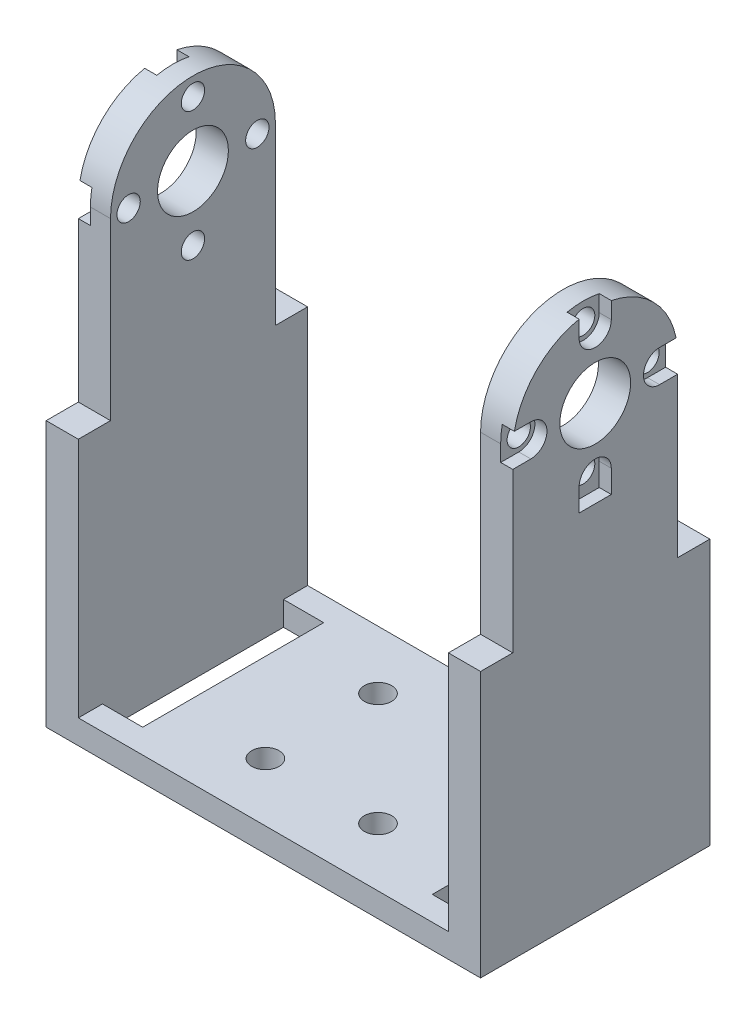
from build123d import *
from build123d.topology import SkipClean

# Parameters (mm, degrees)
SKETCH1_W           = 54
SKETCH1_H           = 28.5
SKETCH1_W_2         = 5
SKETCH1_H_2         = 22.5
SKETCH1_R           = 1.7
SKETCH1_R_2         = 7.5
BOSS_EXTRUDE2_DEPTH = 3
SKETCH2_W           = 4
SKETCH2_H           = 20.5
BOSS_EXTRUDE3_DEPTH = 21.75
SKETCH4_R           = 10.25
BOSS_EXTRUDE4_DEPTH = 4
SKETCH6_R           = 4.4
SKETCH6_R_2         = 1.45
CUT_EXTRUDE3_DEPTH  = 4
SKETCH7_R           = 1.45
CUT_EXTRUDE4_DEPTH  = 1.5
SKETCH8_W           = 28.781481152
SKETCH8_H           = 28.5
BOSS_EXTRUDE5_DEPTH = 3
SKETCH9_R           = 1.7
CUT_EXTRUDE5_DEPTH  = 3
SKETCH10_W          = 54
SKETCH10_H          = 28.5
SKETCH10_R          = 1.7
SKETCH10_W_2        = 5
SKETCH10_H_2        = 22.5
BOSS_EXTRUDE7_DEPTH = 30
SKETCH11_W          = 46
SKETCH11_H          = 30
CUT_EXTRUDE6_DEPTH  = 30


with BuildPart() as part:
    # Sketch1 → Boss-Extrude2 (new body)
    with BuildSketch(Plane(origin=(0, 0, 0), x_dir=(1, 0, 0), z_dir=(0, 1, 0))):
        Rectangle(SKETCH1_W, SKETCH1_H)
        with Locations((20.5, 0)):
            Rectangle(SKETCH1_W_2, SKETCH1_H_2, mode=Mode.SUBTRACT)
        with Locations((-20.5, 0)):
            Rectangle(SKETCH1_W_2, SKETCH1_H_2, mode=Mode.SUBTRACT)
        with Locations(Location((-9, -8.25, 0), (0, 0, 270))):
            Circle(SKETCH1_R, mode=Mode.SUBTRACT)
        with Locations(Location((9, -8.25, 0), (0, 0, 270))):
            Circle(SKETCH1_R, mode=Mode.SUBTRACT)
        with Locations(Location((-9, 8.25, 0), (0, 0, 270))):
            Circle(SKETCH1_R, mode=Mode.SUBTRACT)
        with Locations(Location((0, 0, 0), (0, 0, 270))):
            Circle(SKETCH1_R_2, mode=Mode.SUBTRACT)
        with Locations(Location((9, 8.25, 0), (0, 0, 270))):
            Circle(SKETCH1_R, mode=Mode.SUBTRACT)
    extrude(amount=BOSS_EXTRUDE2_DEPTH)

    # Sketch2 → Boss-Extrude3 (add)
    with BuildSketch(Plane(origin=(0, 3, 0), x_dir=(1, 0, 0), z_dir=(0, 1, 0))):
        with Locations((25, 0)):
            Rectangle(SKETCH2_W, SKETCH2_H)
    boss_extrude3 = extrude(amount=BOSS_EXTRUDE3_DEPTH)

    # Sketch4 → Boss-Extrude4 (add)
    with BuildSketch(Plane(origin=(27, 0, 0), x_dir=(0, 0, -1), z_dir=(1, 0, 0))):
        with Locations((0, 24.75)):
            Circle(SKETCH4_R)
    boss_extrude4 = extrude(amount=-BOSS_EXTRUDE4_DEPTH)

    # Mirror1: Boss-Extrude3, Boss-Extrude4 across plane
    add(boss_extrude3.mirror(Plane(origin=(0, 0, 0), x_dir=(0, 0, 1), z_dir=(1, 0, 0))))
    add(boss_extrude4.mirror(Plane(origin=(0, 0, 0), x_dir=(0, 0, 1), z_dir=(1, 0, 0))))

    # Sketch6 → Cut-Extrude3 (cut)
    with BuildSketch(Plane(origin=(27, 0, 0), x_dir=(0, 0, -1), z_dir=(1, 0, 0))):
        with Locations((0, 24.75)):
            Circle(SKETCH6_R)
        with Locations((0, 32.75)):
            Circle(SKETCH6_R_2)
        with Locations((8, 24.75)):
            Circle(SKETCH6_R_2)
        with Locations((0, 16.75)):
            Circle(SKETCH6_R_2)
        with Locations((-8, 24.75)):
            Circle(SKETCH6_R_2)
    cut_extrude3 = extrude(amount=-CUT_EXTRUDE3_DEPTH, mode=Mode.SUBTRACT)

    # Mirror3: Cut-Extrude3 across plane
    add(cut_extrude3.mirror(Plane(origin=(0, 0, 0), x_dir=(0, 0, 1), z_dir=(1, 0, 0))), mode=Mode.SUBTRACT)

    # Sketch7 → Cut-Extrude4 (cut)
    # profile 1 of 4: a face of its own
    with BuildSketch(Plane(origin=(27, 0, 0), x_dir=(0, 0, -1), z_dir=(1, 0, 0))):
        with BuildLine():
            ThreePointArc((10.25, 24.75), (10.200627247, 25.754840168), (10.052984631, 26.75))
            Line((10.052984631, 26.75), (8, 26.75))
            ThreePointArc((8, 26.75), (6, 24.75), (8, 22.75))
            Line((8, 22.75), (10.25, 22.75))
            Line((10.25, 22.75), (10.25, 24.75))
        make_face()
        with Locations((8, 24.75)):
            Circle(SKETCH7_R, mode=Mode.SUBTRACT)
    # profile 2 of 4: a face of its own
    with BuildSketch(Plane(origin=(27, 0, 0), x_dir=(0, 0, -1), z_dir=(1, 0, 0))):
        with BuildLine():
            Line((2, 32.75), (2, 34.802984631))
            ThreePointArc((2, 34.802984631), (0, 35), (-2, 34.802984631))
            Line((-2, 34.802984631), (-2, 32.75))
            ThreePointArc((-2, 32.75), (0, 30.75), (2, 32.75))
        make_face()
        with Locations((0, 32.75)):
            Circle(SKETCH7_R, mode=Mode.SUBTRACT)
    # profile 3 of 4: a face of its own
    with BuildSketch(Plane(origin=(27, 0, 0), x_dir=(0, 0, -1), z_dir=(1, 0, 0))):
        with BuildLine():
            Line((-8, 26.75), (-10.052984631, 26.75))
            ThreePointArc((-10.052984631, 26.75), (-10.200627247, 25.754840168), (-10.25, 24.75))
            Line((-10.25, 24.75), (-10.25, 22.75))
            Line((-10.25, 22.75), (-8, 22.75))
            ThreePointArc((-8, 22.75), (-6, 24.75), (-8, 26.75))
        make_face()
        with Locations((-8, 24.75)):
            Circle(SKETCH7_R, mode=Mode.SUBTRACT)
    # profile 4 of 4: a face of its own
    with BuildSketch(Plane(origin=(27, 0, 0), x_dir=(0, 0, -1), z_dir=(1, 0, 0))):
        with BuildLine():
            Line((-2, 16.75), (-2, 13.927640071))
            Line((-2, 13.927640071), (2, 13.927640071))
            Line((2, 13.927640071), (2, 16.75))
            ThreePointArc((2, 16.75), (0, 18.75), (-2, 16.75))
        make_face()
        with Locations((0, 16.75)):
            Circle(SKETCH7_R, mode=Mode.SUBTRACT)
    cut_extrude4 = extrude(amount=-CUT_EXTRUDE4_DEPTH, mode=Mode.SUBTRACT)

    # Mirror4: Cut-Extrude4 across plane
    add(cut_extrude4.mirror(Plane(origin=(0, 0, 0), x_dir=(0, 0, 1), z_dir=(1, 0, 0))), mode=Mode.SUBTRACT)

    # Sketch8 → Boss-Extrude5 (add)
    with BuildSketch(Plane(origin=(0, 3, 0), x_dir=(1, 0, 0), z_dir=(0, 1, 0))):
        Rectangle(SKETCH8_W, SKETCH8_H)
    extrude(amount=-BOSS_EXTRUDE5_DEPTH)

    # Sketch9 → Cut-Extrude5 (cut)
    with BuildSketch(Plane(origin=(0, 3, 0), x_dir=(1, 0, 0), z_dir=(0, 1, 0))):
        with BuildLine():
            ThreePointArc((-5.3, -7), (-5.797918472, -5.797918472), (-7, -5.3))
            Line((-7, -5.3), (-7, -7))
            Line((-7, -7), (-5.3, -7))
        make_face()
        with BuildLine():
            Line((-7, -7), (-7, -5.3))
            ThreePointArc((-7, -5.3), (-8.202081528, -8.202081528), (-5.3, -7))
            Line((-5.3, -7), (-7, -7))
        make_face()
        with BuildLine():
            ThreePointArc((8.7, -7), (8.202081528, -5.797918472), (7, -5.3))
            Line((7, -5.3), (7, -7))
            Line((7, -7), (5.3, -7))
            ThreePointArc((5.3, -7), (7, -8.7), (8.7, -7))
        make_face()
        with BuildLine():
            Line((7, -7), (7, -5.3))
            ThreePointArc((7, -5.3), (5.797918472, -5.797918472), (5.3, -7))
            Line((5.3, -7), (7, -7))
        make_face()
        with BuildLine():
            ThreePointArc((8.7, 7), (7, 8.7), (5.3, 7))
            Line((5.3, 7), (7, 7))
            Line((7, 7), (7, 5.3))
            ThreePointArc((7, 5.3), (8.202081528, 5.797918472), (8.7, 7))
        make_face()
        with BuildLine():
            Line((7, 7), (5.3, 7))
            ThreePointArc((5.3, 7), (5.797918472, 5.797918472), (7, 5.3))
            Line((7, 5.3), (7, 7))
        make_face()
        with Locations(Location((-7, 7, 0), (0, 0, 270))):
            Circle(SKETCH9_R)
    extrude(amount=-CUT_EXTRUDE5_DEPTH, mode=Mode.SUBTRACT)

    # Sketch10 → Boss-Extrude7 (add)
    with SkipClean():  # the faces are left unmerged after this step: merging them gives an invalid solid
        with BuildSketch(Plane.XZ):
            Rectangle(SKETCH10_W, SKETCH10_H)
            with Locations(Location((-7, 7, 0), (0, 0, 90))):
                Circle(SKETCH10_R, mode=Mode.SUBTRACT)
            with Locations(Location((7, 7, 0), (0, 0, 90))):
                Circle(SKETCH10_R, mode=Mode.SUBTRACT)
            with Locations(Location((7, -7, 0), (0, 0, 90))):
                Circle(SKETCH10_R, mode=Mode.SUBTRACT)
            with Locations(Location((-7, -7, 0), (0, 0, 90))):
                Circle(SKETCH10_R, mode=Mode.SUBTRACT)
            with Locations((-20.5, 0)):
                Rectangle(SKETCH10_W_2, SKETCH10_H_2, mode=Mode.SUBTRACT)
            with Locations((20.5, 0)):
                Rectangle(SKETCH10_W_2, SKETCH10_H_2, mode=Mode.SUBTRACT)
        extrude(amount=BOSS_EXTRUDE7_DEPTH)

    # Sketch11 → Cut-Extrude6 (cut)
    with BuildSketch(Plane.XY.offset(14.25)):
        with Locations((0, -12)):
            Rectangle(SKETCH11_W, SKETCH11_H)
    extrude(amount=-CUT_EXTRUDE6_DEPTH, mode=Mode.SUBTRACT)


solid = part.part
